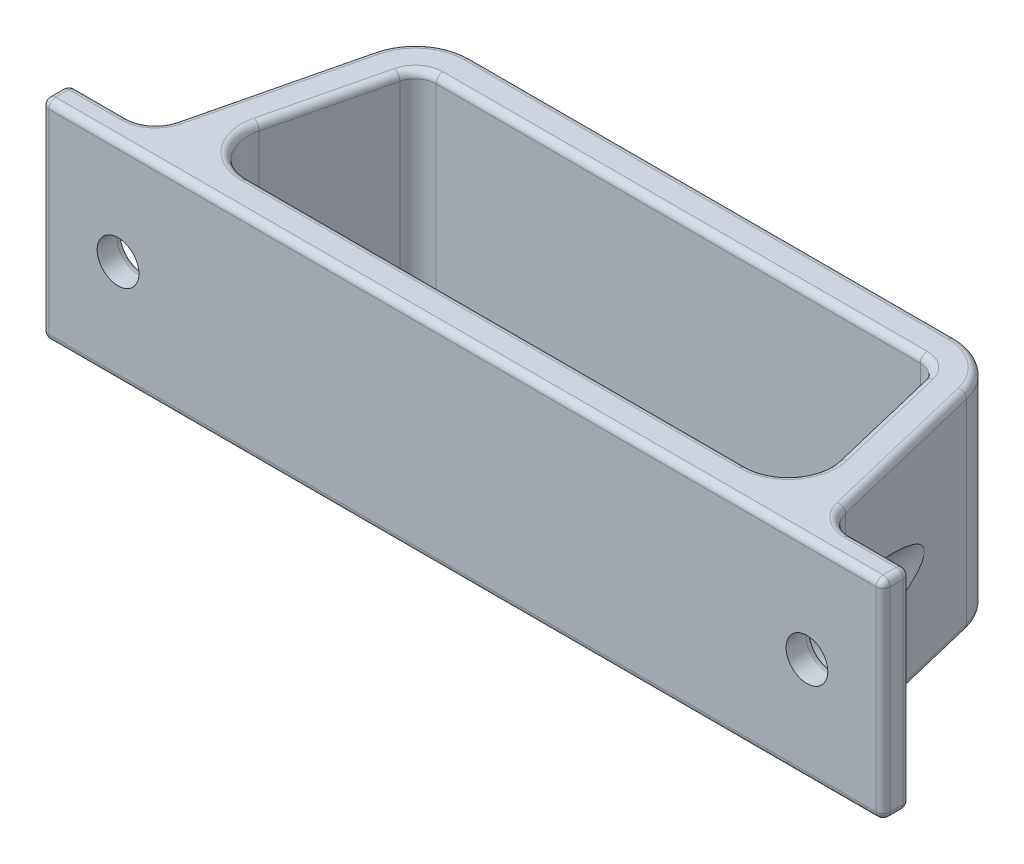
from build123d import *

# Parameters (mm, degrees)
BOSS_EXTRUDE3_DEPTH = 15
SKETCH9_R           = 1.5
CUT_EXTRUDE1_DEPTH  = 15
SKETCH10_R          = 2.5
CUT_EXTRUDE2_DEPTH  = 16.0625
FILLET1_R           = 0.5


with BuildPart() as part:
    # Sketch1 → Boss-Extrude3 (new body)
    with BuildSketch(Plane(origin=(0, 0, 0), x_dir=(1, 0, 0), z_dir=(0, 1, 0))):
        with BuildLine():
            ThreePointArc((13.190173945, 18), (15.664817709, 17.142632374), (17.078621749, 14.93806912))
            Line((17.078621749, 14.93806912), (19.845607851, 3.46846544))
            ThreePointArc((19.845607851, 3.46846544), (20.552509871, 2.366183813), (21.789831753, 1.9375))
            Line((21.789831753, 1.9375), (25.516709926, 1.9375))
            ThreePointArc((25.516709926, 1.9375), (25.870263317, 1.791053391), (26.016709926, 1.4375))
            Line((26.016709926, 1.4375), (26.016709926, 0.5))
            ThreePointArc((26.016709926, 0.5), (25.870263317, 0.146446609), (25.516709926, 0))
            Line((25.516709926, 0), (-33.926764109, 0))
            ThreePointArc((-33.926764109, 0), (-34.280317499, 0.146446609), (-34.426764109, 0.5))
            Line((-34.426764109, 0.5), (-34.426764109, 1.4375))
            ThreePointArc((-34.426764109, 1.4375), (-34.280317499, 1.791053391), (-33.926764109, 1.9375))
            Line((-33.926764109, 1.9375), (-30.199885936, 1.9375))
            ThreePointArc((-30.199885936, 1.9375), (-28.962564054, 2.366183813), (-28.255662034, 3.46846544))
            Line((-28.255662034, 3.46846544), (-25.488675932, 14.93806912))
            ThreePointArc((-25.488675932, 14.93806912), (-24.074871892, 17.142632374), (-21.600228128, 18))
            Line((-21.600228128, 18), (13.190173945, 18))
        make_face()
        with BuildLine():
            Line((-21.600228128, 15.5), (13.190173945, 15.5))
            ThreePointArc((13.190173945, 15.5), (14.118165357, 15.17848714), (14.648341872, 14.35177592))
            Line((14.648341872, 14.35177592), (16.6140613, 6.20355184))
            ThreePointArc((16.6140613, 6.20355184), (16.054699727, 3.644017177), (13.697725446, 2.5))
            Line((13.697725446, 2.5), (-22.107779629, 2.5))
            ThreePointArc((-22.107779629, 2.5), (-24.46475391, 3.644017177), (-25.024115482, 6.20355184))
            Line((-25.024115482, 6.20355184), (-23.058396054, 14.35177592))
            ThreePointArc((-23.058396054, 14.35177592), (-22.52821954, 15.17848714), (-21.600228128, 15.5))
        make_face(mode=Mode.SUBTRACT)
    extrude(amount=BOSS_EXTRUDE3_DEPTH)

    # Sketch9 → Cut-Extrude1 (cut)
    with BuildSketch(Plane.XY):
        with Locations((-28.955027091, 7.5)):
            Circle(SKETCH9_R)
        with Locations((20.544972909, 7.5)):
            Circle(SKETCH9_R)
    extrude(amount=-CUT_EXTRUDE1_DEPTH, mode=Mode.SUBTRACT)

    # Sketch10 → Cut-Extrude2 (cut)
    with BuildSketch(Plane(origin=(0, 0, -18), x_dir=(-1, 0, 0), z_dir=(0, 0, -1))):
        with Locations((-20.544972909, 7.5)):
            Circle(SKETCH10_R)
        with Locations((28.955027091, 7.5)):
            Circle(SKETCH10_R)
    extrude(amount=-CUT_EXTRUDE2_DEPTH, mode=Mode.SUBTRACT)

    # Fillet1
    fillet1_edges = [part.edges().sort_by_distance(p)[0] for p in [
        (16.054699727, 15, -3.644017177),
        (-4.205027091, 15, -2.5),
        (-24.46475391, 15, -3.644017177),
        (-24.041255768, 15, -10.27766388),
        (-4.205027091, 15, -18),
        (-22.52821954, 15, -15.17848714),
        (-24.074871892, 15, -17.142632374),
        (-26.872168983, 15, -9.20326728),
        (-22.52821954, 0, -15.17848714),
        (-24.041255768, 0, -10.27766388),
        (-28.962564054, 15, -2.366183813),
        (-24.46475391, 0, -3.644017177),
        (-4.205027091, 0, -2.5),
        (16.054699727, 0, -3.644017177),
        (15.631201586, 0, -10.27766388),
        (14.118165357, 0, -15.17848714),
        (-4.205027091, 0, -15.5),
        (18.4621148, 0, -9.20326728),
        (20.552509871, 0, -2.366183813),
        (23.65327084, 0, -1.9375),
        (25.870263317, 0, -1.791053391),
        (-32.063325022, 15, -1.9375),
        (26.016709926, 0, -0.96875),
        (25.870263317, 0, -0.146446609),
        (-4.205027091, 0, 0),
        (-34.280317499, 0, -0.146446609),
        (-34.426764109, 0, -0.96875),
        (-34.280317499, 0, -1.791053391),
        (-32.063325022, 0, -1.9375),
        (-28.962564054, 0, -2.366183813),
        (-26.872168983, 0, -9.20326728),
        (-24.074871892, 0, -17.142632374),
        (-34.280317499, 15, -1.791053391),
        (-4.205027091, 0, -18),
        (15.664817709, 0, -17.142632374),
        (-34.426764109, 15, -0.96875),
        (-34.280317499, 15, -0.146446609),
        (-4.205027091, 15, 0),
        (25.870263317, 15, -0.146446609),
        (26.016709926, 15, -0.96875),
        (25.870263317, 15, -1.791053391),
        (15.664817709, 15, -17.142632374),
        (23.65327084, 15, -1.9375),
        (20.552509871, 15, -2.366183813),
        (-30.455027091, 7.5, -1.9375),
        (18.4621148, 15, -9.20326728),
        (19.044972909, 7.5, -1.9375),
        (-4.205027091, 15, -15.5),
        (14.118165357, 15, -15.17848714),
        (15.631201586, 15, -10.27766388),
    ]]
    fillet(fillet1_edges, radius=FILLET1_R)


solid = part.part
